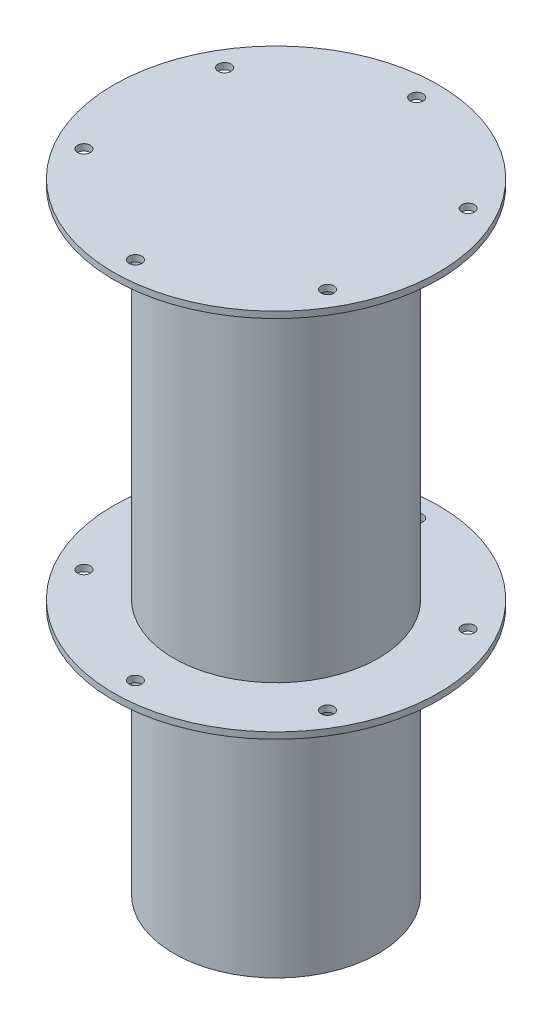
from build123d import *

# Parameters (mm, degrees)
SKETCH2_R          = 6.35
CUT_EXTRUDE1_DEPTH = 657.861735142


with BuildPart() as part:
    # Sketch1 → Revolve1 (revolve)
    with BuildSketch(Plane.XY, mode=Mode.PRIVATE) as revolve1_sk:
        Polygon((101.6, -36.990823201), (101.6, 318.609176799), (161.358198728, 318.609176799), (161.358198728, 324.959176799), (101.6, 324.959176799), (0, 324.959176799), (0, 318.609176799), (0, -290.990823201), (101.6, -290.990823201), (101.6, -43.340823201), (161.358198728, -43.340823201), (161.358198728, -36.990823201), align=None)
        Polygon((101.6, 324.959176799), (0, 324.959176799), (0, 318.609176799), (0, -290.990823201), (101.6, -290.990823201), (101.6, -43.340823201), (161.358198728, -43.340823201), (161.358198728, -36.990823201), (101.6, -36.990823201), (101.6, 318.609176799), (161.358198728, 318.609176799), (161.358198728, 324.959176799), align=None)
    revolve(revolve1_sk.sketch.rotate(Axis((0, 318.609176799, 0), (0, -1, 0)), 180), axis=Axis((0, 318.609176799, 0), (0, -1, 0)))

    # Sketch2 → Cut-Extrude1 (cut, through all)
    with BuildSketch(Plane(origin=(0, 324.959176799, 0), x_dir=(1, 0, 0), z_dir=(0, 1, 0))):
        with Locations(Location((0, 139.7, 0), (0, 0, 180))):
            Circle(SKETCH2_R)
        with Locations(Location((120.983748909, 69.85, 0), (0, 0, 180))):
            Circle(SKETCH2_R)
        with Locations(Location((120.983748909, -69.85, 0), (0, 0, 180))):
            Circle(SKETCH2_R)
        with Locations(Location((0, -139.7, 0), (0, 0, 180))):
            Circle(SKETCH2_R)
        with Locations(Location((-120.983748909, -69.85, 0), (0, 0, 180))):
            Circle(SKETCH2_R)
        with Locations(Location((-120.983748909, 69.85, 0), (0, 0, 180))):
            Circle(SKETCH2_R)
    extrude(amount=-CUT_EXTRUDE1_DEPTH, mode=Mode.SUBTRACT)


solid = part.part
